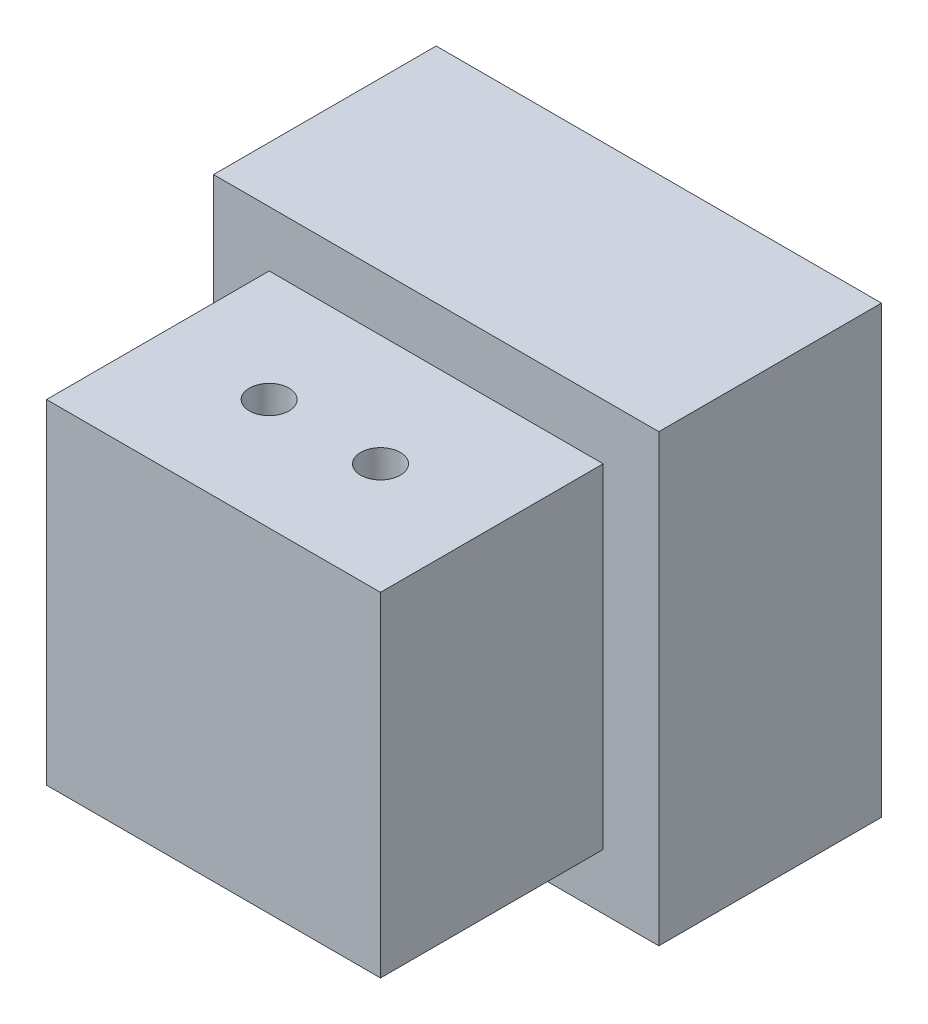
from build123d import *

# Parameters (mm, degrees)
SKETCH1_W                 = 19.05
SKETCH1_H                 = 19.05
BOSS_EXTRUDE1_DEPTH       = 12.7
SKETCH2_W                 = 25.4
SKETCH2_H                 = 25.4
BOSS_EXTRUDE2_DEPTH       = 12.7
SKETCH3_R                 = 9.525
CUT_EXTRUDE3_DEPTH        = 10.16
TAP_DRILL_FOR_4_40_TAP1_D = 2.2606


with BuildPart() as part:
    # Sketch1 → Boss-Extrude1 (new body)
    with BuildSketch(Plane.XY):
        with Locations((-12.7, 12.7)):
            Rectangle(SKETCH1_W, SKETCH1_H)
    extrude(amount=BOSS_EXTRUDE1_DEPTH)

    # Sketch2 → Boss-Extrude2 (add)
    with BuildSketch(Plane(origin=(0, 0, 0), x_dir=(-1, 0, 0), z_dir=(0, 0, -1))):
        with Locations((12.7, 12.7)):
            Rectangle(SKETCH2_W, SKETCH2_H)
    extrude(amount=BOSS_EXTRUDE2_DEPTH)

    # Sketch3 → Cut-Extrude3 (cut)
    with BuildSketch(Plane(origin=(0, 0, -12.7), x_dir=(-1, 0, 0), z_dir=(0, 0, -1))):
        with Locations((12.7, 12.7)):
            Circle(SKETCH3_R)
    extrude(amount=-CUT_EXTRUDE3_DEPTH, mode=Mode.SUBTRACT)

    # Tap Drill for #4-40 Tap1 (through all)
    with Locations(Plane(origin=(0, 22.225, 0), x_dir=(1, 0, 0), z_dir=(0, 1, 0))):
        with Locations((-9.525, -6.35), (-15.875, -6.35)):
            Hole(TAP_DRILL_FOR_4_40_TAP1_D / 2)


solid = part.part
